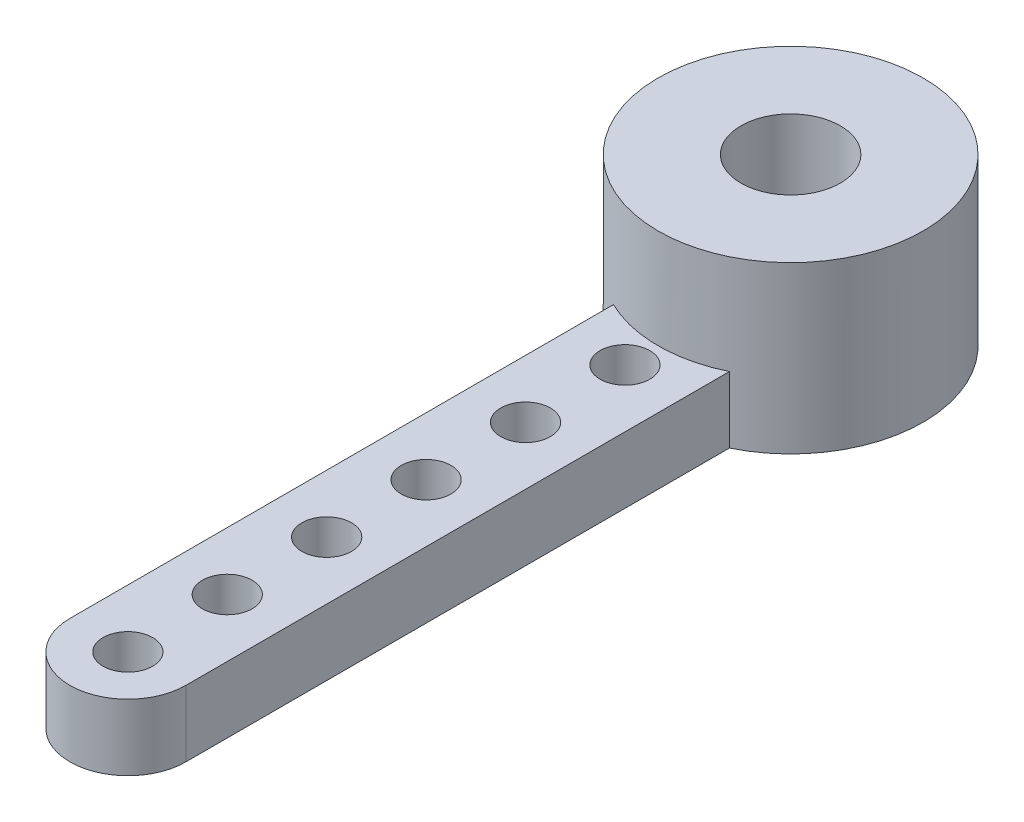
from build123d import *

# Parameters (mm, degrees)
SKETCH1_R           = 8
SKETCH1_R_2         = 1.5
BOSS_EXTRUDE1_DEPTH = 10
SKETCH2_R           = 3
CUT_EXTRUDE1_DEPTH  = 6
SKETCH3_R           = 1.5
CUT_EXTRUDE2_DEPTH  = 6
CUT_EXTRUDE4_START  = -6
CUT_EXTRUDE4_DEPTH  = 6


with BuildPart() as part:
    # Sketch1 → Boss-Extrude1 (new body)
    # profile 1 of 2: a face of its own
    with BuildSketch(Plane(origin=(0, 0, 0), x_dir=(1, 0, 0), z_dir=(0, 1, 0))):
        Circle(SKETCH1_R)
    # profile 2 of 2: a face of its own
    with BuildSketch(Plane(origin=(0, 0, 0), x_dir=(1, 0, 0), z_dir=(0, 1, 0))):
        with BuildLine():
            Line((3.5, 0), (3.5, -40))
            ThreePointArc((3.5, -40), (0, -43.5), (-3.5, -40))
            Line((-3.5, -40), (-3.5, 0))
            ThreePointArc((-3.5, 0), (0, 3.5), (3.5, 0))
        make_face()
        with Locations(Location((0, -40, 0), (0, 0, 270))):
            Circle(SKETCH1_R_2, mode=Mode.SUBTRACT)
        with Locations(Location((0, -34, 0), (0, 0, 270))):
            Circle(SKETCH1_R_2, mode=Mode.SUBTRACT)
        with Locations(Location((0, -28, 0), (0, 0, 270))):
            Circle(SKETCH1_R_2, mode=Mode.SUBTRACT)
        with Locations(Location((0, -22, 0), (0, 0, 270))):
            Circle(SKETCH1_R_2, mode=Mode.SUBTRACT)
        with Locations(Location((0, -16, 0), (0, 0, 270))):
            Circle(SKETCH1_R_2, mode=Mode.SUBTRACT)
        with Locations(Location((0, -10, 0), (0, 0, 270))):
            Circle(SKETCH1_R_2, mode=Mode.SUBTRACT)
    extrude(amount=BOSS_EXTRUDE1_DEPTH)

    # Sketch2 → Cut-Extrude1 (cut)
    with BuildSketch(Plane(origin=(0, 10, 0), x_dir=(1, 0, 0), z_dir=(0, 1, 0))):
        with Locations(Location((0, 0, 0), (0, 0, 270))):
            Circle(SKETCH2_R)
    extrude(amount=-CUT_EXTRUDE1_DEPTH, mode=Mode.SUBTRACT)

    # Sketch3 → Cut-Extrude2 (cut)
    with BuildSketch(Plane(origin=(0, 4, 0), x_dir=(1, 0, 0), z_dir=(0, 1, 0))):
        with Locations(Location((0, 0, 0), (0, 0, 270))):
            Circle(SKETCH3_R)
    extrude(amount=-CUT_EXTRUDE2_DEPTH, mode=Mode.SUBTRACT)

    # Sketch4 → Cut-Extrude4 (cut)
    with BuildSketch(Plane(origin=(0, 10, 0), x_dir=(1, 0, 0), z_dir=(0, 1, 0)).offset(CUT_EXTRUDE4_START)):
        with BuildLine():
            Line((3.5, -40), (3.5, -7.193747285))
            ThreePointArc((3.5, -7.193747285), (0, -8), (-3.5, -7.193747285))
            Line((-3.5, -7.193747285), (-3.5, -40))
            ThreePointArc((-3.5, -40), (0, -43.5), (3.5, -40))
        make_face()
    extrude(amount=CUT_EXTRUDE4_DEPTH, mode=Mode.SUBTRACT)


solid = part.part
